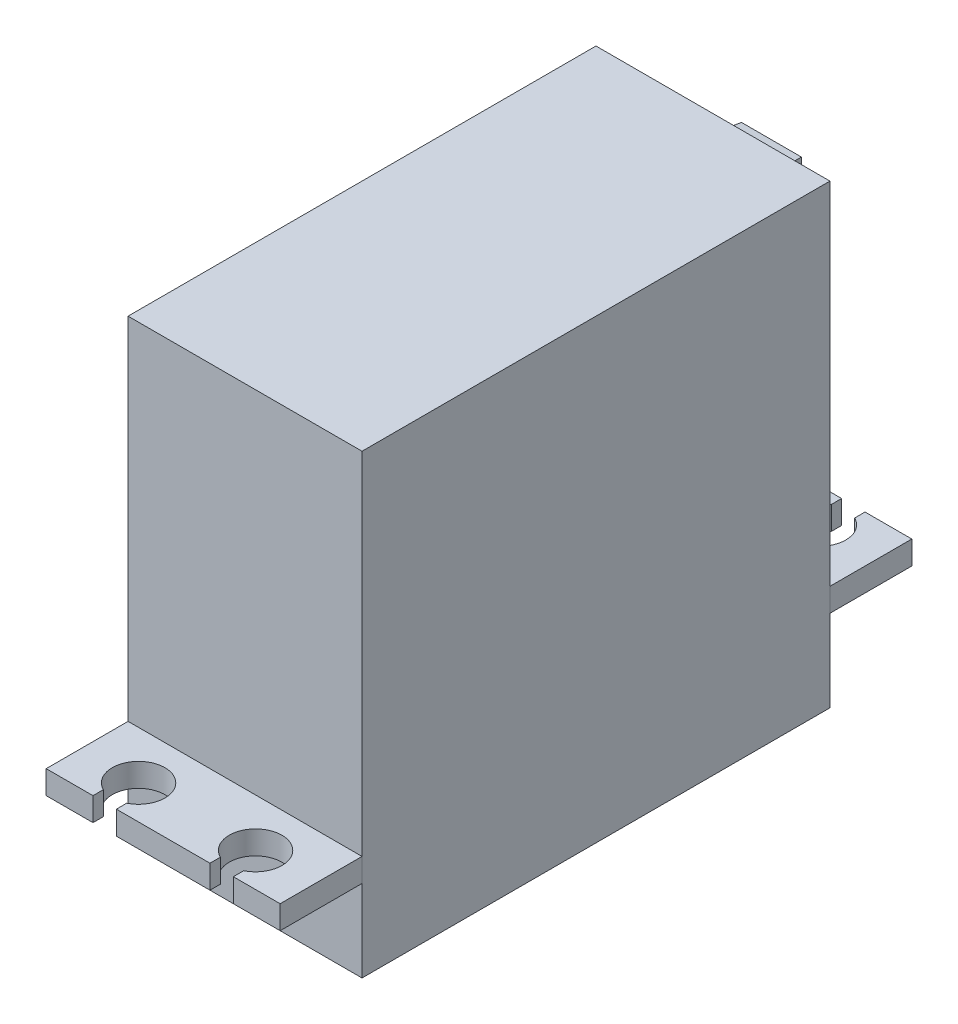
from build123d import *

# Parameters (mm, degrees)
SKETCH_1_W             = 20
SKETCH_1_H             = 40
EXTRUDE_1_DEPTH        = 39
SKETCH_2_R             = 6.5
EXTRUDE_2_DEPTH        = 2.1
SKETCH_3_R             = 2.9
EXTRUDE_3_DEPTH        = 3.5
SKETCH_4_W             = 6
SKETCH_4_H             = 3
EXTRUDE_4_DEPTH        = 5
EXTRUDE_4_TAPER        = 5
EXTRUDE_5_DEPTH        = 1
EXTRUDE_5_DEPTH_BACK   = 1
EXTRUDE_5_2_DEPTH      = 1
EXTRUDE_5_2_DEPTH_BACK = 1


with BuildPart() as part:
    # 草图1 → 凸台-拉伸1 (new body)
    with BuildSketch(Plane(origin=(0, 0, 0), x_dir=(1, 0, 0), z_dir=(0, 1, 0))):
        Rectangle(SKETCH_1_W, SKETCH_1_H)
    extrude(amount=EXTRUDE_1_DEPTH)

    # 草图2 → 凸台-拉伸2 (add)
    with BuildSketch(Plane.XZ):
        with Locations(Location((0, -10, 0), (0, 0, 90))):
            Circle(SKETCH_2_R)
    extrude(amount=EXTRUDE_2_DEPTH)

    # 草图3 → 凸台-拉伸3 (add)
    with BuildSketch(Plane.XZ.offset(2.1)):
        with Locations(Location((0, -10, 0), (0, 0, 270))):
            Circle(SKETCH_3_R)
    extrude(amount=EXTRUDE_3_DEPTH)

    # 草图4 → 凸台-拉伸4 (add)
    with BuildSketch(Plane(origin=(0, 0, -20), x_dir=(-1, 0, 0), z_dir=(0, 0, -1))):
        with Locations((0, 33.5)):
            Rectangle(SKETCH_4_W, SKETCH_4_H)
    extrude(amount=EXTRUDE_4_DEPTH, taper=EXTRUDE_4_TAPER)


with BuildPart() as body_2:
    # 草图5 → 凸台-拉伸5 (new, two sides: drawn at the far end of the back side and taken through both)
    with BuildSketch(Plane(origin=(0, 8, 0), x_dir=(-1, 0, 0), z_dir=(0, -1, 0)).offset(-EXTRUDE_5_DEPTH_BACK)):
        with BuildLine():
            Line((-10, -20), (10, -20))
            Line((10, -20), (10, -27))
            Line((10, -27), (6, -27))
            Line((6, -27), (6, -26.115564437))
            ThreePointArc((6, -26.115564437), (5, -21.85), (4, -26.115564437))
            Line((4, -26.115564437), (4, -27))
            Line((4, -27), (-4, -27))
            Line((-4, -27), (-4, -26.115564437))
            ThreePointArc((-4, -26.115564437), (-5, -21.85), (-6, -26.115564437))
            Line((-6, -26.115564437), (-6, -27))
            Line((-6, -27), (-10, -27))
            Line((-10, -27), (-10, -20))
        make_face()
    extrude(amount=EXTRUDE_5_DEPTH + EXTRUDE_5_DEPTH_BACK)


with BuildPart() as body_3:
    # 草图5 → Extrude 5 2 (new, two sides: drawn at the far end of the back side and taken through both)
    with BuildSketch(Plane(origin=(0, 8, 0), x_dir=(-1, 0, 0), z_dir=(0, -1, 0)).offset(-EXTRUDE_5_2_DEPTH_BACK)):
        with BuildLine():
            Line((-10, 20), (10, 20))
            Line((10, 20), (10, 27))
            Line((10, 27), (6, 27))
            Line((6, 27), (6, 26.115564437))
            ThreePointArc((6, 26.115564437), (5, 21.85), (4, 26.115564437))
            Line((4, 26.115564437), (4, 27))
            Line((4, 27), (-4, 27))
            Line((-4, 27), (-4, 26.115564437))
            ThreePointArc((-4, 26.115564437), (-5, 21.85), (-6, 26.115564437))
            Line((-6, 26.115564437), (-6, 27))
            Line((-6, 27), (-10, 27))
            Line((-10, 27), (-10, 20))
        make_face()
    extrude(amount=EXTRUDE_5_2_DEPTH + EXTRUDE_5_2_DEPTH_BACK)


solid = Compound([part.part, body_2.part, body_3.part])
